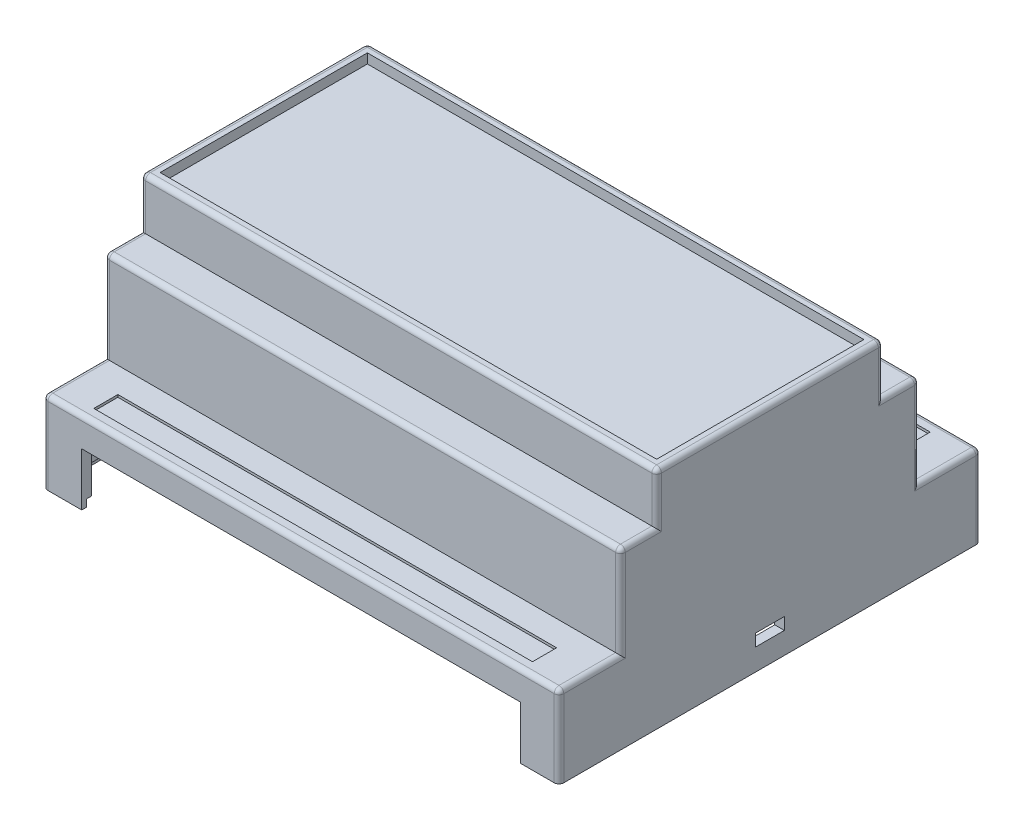
from build123d import *

# Parameters (mm, degrees)
BOSS_EXTRUDE1_DEPTH = 2
BOSS_EXTRUDE2_DEPTH = 103
BOSS_EXTRUDE3_DEPTH = 2
SKETCH4_W           = 103
SKETCH4_H           = 43
CUT_EXTRUDE1_DEPTH  = 2
SKETCH5_W           = 91
SKETCH5_H           = 5
CUT_EXTRUDE2_DEPTH  = 0.5
SKETCH7_W           = 105
SKETCH7_H           = 85.5
SKETCH7_W_2         = 103
SKETCH7_H_2         = 83.5
CUT_EXTRUDE3_DEPTH  = 1.5
CUT_EXTRUDE4_REACH  = 142.164
SKETCH8_W           = 91
SKETCH8_H           = 11
CUT_EXTRUDE5_REACH  = 119.914
SKETCH9_W           = 6
SKETCH9_H           = 2.5
FILLET1_R           = 1


with BuildPart() as part:
    # Sketch1 → Boss-Extrude1 (new body)
    with BuildSketch(Plane(origin=(0, 0, 0), x_dir=(0, 0, -1), z_dir=(1, 0, 0))):
        Polygon((-43.75, -23.25), (43.75, -23.25), (43.75, -6.25), (31, -6.25), (31, 12.75), (23.5, 12.75), (23.5, 23.25), (-23.5, 23.25), (-23.5, 12.75), (-31, 12.75), (-31, -6.25), (-43.75, -6.25), align=None)
    extrude(amount=-BOSS_EXTRUDE1_DEPTH)

    # Sketch2 → Boss-Extrude2 (add)
    with BuildSketch(Plane.ZY.offset(2)):
        Polygon((-43.75, -23.25), (-43.75, -6.25), (-31, -6.25), (-31, 12.75), (-23.5, 12.75), (-23.5, 23.25), (23.5, 23.25), (23.5, 12.75), (31, 12.75), (31, -6.25), (43.75, -6.25), (43.75, -23.25), (41.75, -23.25), (41.75, -7.25), (28.5, -7.25), (28.5, 11.75), (22.5, 11.75), (22.5, 19.75), (-22.5, 19.75), (-22.5, 11.75), (-28.5, 11.75), (-28.5, -7.25), (-41.75, -7.25), (-41.75, -23.25), align=None)
    extrude(amount=BOSS_EXTRUDE2_DEPTH)

    # Sketch3 → Boss-Extrude3 (add)
    with BuildSketch(Plane.ZY.offset(105)):
        Polygon((43.75, -23.25), (43.75, -6.25), (31, -6.25), (31, 12.75), (23.5, 12.75), (23.5, 23.25), (-23.5, 23.25), (-23.5, 12.75), (-31, 12.75), (-31, -6.25), (-43.75, -6.25), (-43.75, -23.25), align=None)
    extrude(amount=BOSS_EXTRUDE3_DEPTH)

    # Sketch4 → Cut-Extrude1 (cut)
    with BuildSketch(Plane(origin=(0, 23.25, 0), x_dir=(1, 0, 0), z_dir=(0, 1, 0))):
        with Locations((-53.5, 0)):
            Rectangle(SKETCH4_W, SKETCH4_H)
    extrude(amount=-CUT_EXTRUDE1_DEPTH, mode=Mode.SUBTRACT)

    # Sketch5 → Cut-Extrude2 (cut)
    with BuildSketch(Plane(origin=(0, -6.25, 0), x_dir=(1, 0, 0), z_dir=(0, 1, 0))):
        with Locations((-53.5, -38.75)):
            Rectangle(SKETCH5_W, SKETCH5_H)
        with Locations((-53.5, 38.75)):
            Rectangle(SKETCH5_W, SKETCH5_H)
    extrude(amount=-CUT_EXTRUDE2_DEPTH, mode=Mode.SUBTRACT)

    # Sketch7 → Cut-Extrude3 (cut)
    with BuildSketch(Plane.XZ.offset(23.25)):
        with Locations((-53.5, 0)):
            Rectangle(SKETCH7_W, SKETCH7_H)
        with Locations((-53.5, 0)):
            Rectangle(SKETCH7_W_2, SKETCH7_H_2, mode=Mode.SUBTRACT)
    extrude(amount=-CUT_EXTRUDE3_DEPTH, mode=Mode.SUBTRACT)

    # Cut-Extrude4: up to this face of the body (flat: up to its plane)
    cut_extrude4_end = Plane(part.part.faces().sort_by_distance((-53.5, -14.75, -43.75))[0])
    # Sketch8 → Cut-Extrude4 (cut, up to the picked face)
    with BuildSketch(Plane.XY.offset(43.75), mode=Mode.PRIVATE) as cut_extrude4_sk1:
        with Locations((-53.5, -17.75)):
            Rectangle(SKETCH8_W, SKETCH8_H)
    cut_extrude4_tool1 = split(extrude(cut_extrude4_sk1.sketch, amount=-CUT_EXTRUDE4_REACH, mode=Mode.PRIVATE), bisect_by=cut_extrude4_end, keep=Keep.BOTH, mode=Mode.PRIVATE)
    add(cut_extrude4_tool1.solids().sort_by(Axis((-53.5, -17.75, 43.75), (0, 0, -1)))[0], mode=Mode.SUBTRACT)

    # Cut-Extrude5: up to this face of the body (flat: up to its plane)
    cut_extrude5_end = Plane(part.part.faces().sort_by_distance((-107, -2.921533713, 0))[0])
    # Sketch9 → Cut-Extrude5 (cut, up to the picked face)
    with BuildSketch(Plane(origin=(0, 0, 0), x_dir=(0, 0, -1), z_dir=(1, 0, 0)), mode=Mode.PRIVATE) as cut_extrude5_sk1:
        with Locations((0, -17.5)):
            Rectangle(SKETCH9_W, SKETCH9_H)
    cut_extrude5_tool1 = split(extrude(cut_extrude5_sk1.sketch, amount=-CUT_EXTRUDE5_REACH, mode=Mode.PRIVATE), bisect_by=cut_extrude5_end, keep=Keep.BOTH, mode=Mode.PRIVATE)
    add(cut_extrude5_tool1.solids().sort_by(Axis((0, -17.5, 0), (-1, 0, 0)))[0], mode=Mode.SUBTRACT)

    # Fillet1
    fillet1_edges = [part.edges().sort_by_distance(p)[0] for p in [
        (-107, -6.25, 37.375),
        (-107, 3.25, 31),
        (-107, 12.75, 27.25),
        (-107, 18, 23.5),
        (-107, 23.25, 0),
        (-107, 18, -23.5),
        (-107, 12.75, -27.25),
        (-107, 3.25, -31),
        (-107, -6.25, -37.375),
        (-107, -14.75, -43.75),
        (-107, -14.75, 43.75),
        (0, -6.25, 37.375),
        (0, 3.25, 31),
        (0, 12.75, 27.25),
        (0, 18, 23.5),
        (0, 23.25, 0),
        (0, 18, -23.5),
        (0, 12.75, -27.25),
        (0, 3.25, -31),
        (0, -6.25, -37.375),
        (0, -14.75, -43.75),
        (0, -14.75, 43.75),
        (-53.5, -6.25, 43.75),
        (-53.5, 12.75, 31),
        (-53.5, 23.25, 23.5),
        (-53.5, 23.25, -23.5),
        (-53.5, 12.75, -31),
        (-53.5, -6.25, -43.75),
    ]]
    fillet(fillet1_edges, radius=FILLET1_R)


solid = part.part
